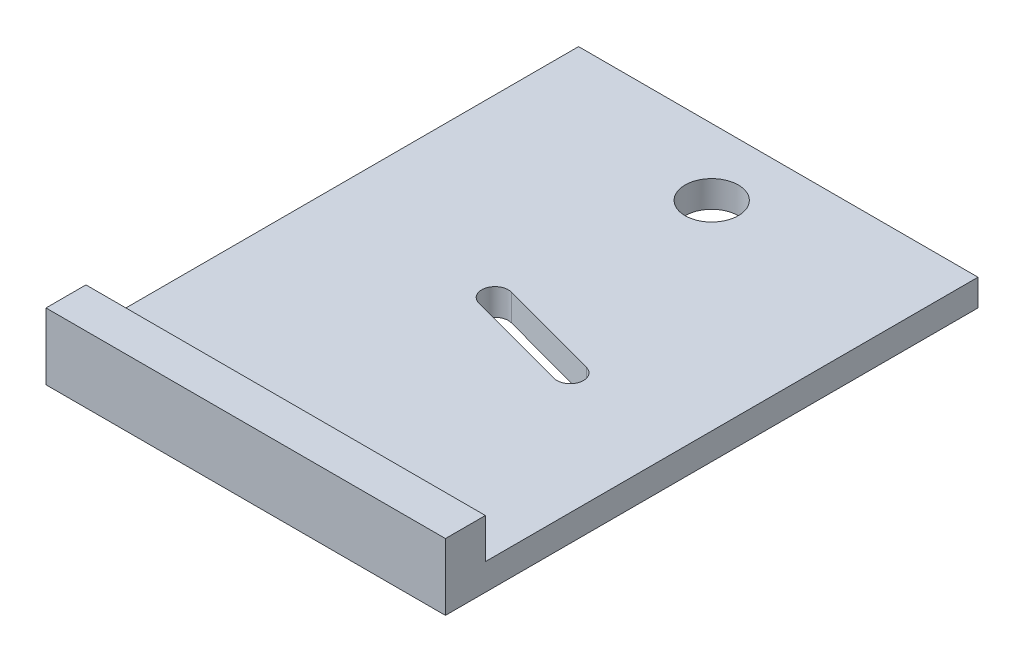
from build123d import *

# Parameters (mm, degrees)
SKETCH1_W                 = 60
SKETCH1_H                 = 80
BOSS_EXTRUDE1_DEPTH       = 4
SKETCH2_W                 = 60
SKETCH2_H                 = 10
BOSS_EXTRUDE2_DEPTH       = 6
F_8_0MM_DOWEL_HOLE1_D     = 8
F_8_0MM_DOWEL_HOLE1_DEPTH = 6
CUT_EXTRUDE1_DEPTH        = 101.498756211


with BuildPart() as part:
    # Sketch1 → Boss-Extrude1 (new body)
    with BuildSketch(Plane(origin=(0, 0, 0), x_dir=(1, 0, 0), z_dir=(0, 1, 0))):
        with Locations((30, 40)):
            Rectangle(SKETCH1_W, SKETCH1_H)
    extrude(amount=BOSS_EXTRUDE1_DEPTH)

    # Sketch2 → Boss-Extrude2 (add)
    with BuildSketch(Plane.XY):
        with Locations((30, 5)):
            Rectangle(SKETCH2_W, SKETCH2_H)
    extrude(amount=-BOSS_EXTRUDE2_DEPTH)

    # Ø8.0mm Dowel Hole1
    with Locations(Plane(origin=(0, 4, 0), x_dir=(1, 0, 0), z_dir=(0, 1, 0))):
        with Locations((30, 70)):
            Hole(F_8_0MM_DOWEL_HOLE1_D / 2, depth=F_8_0MM_DOWEL_HOLE1_DEPTH)

    # Sketch6 → Cut-Extrude1 (cut, through all)
    with BuildSketch(Plane.XZ):
        with BuildLine():
            Line((25.84299387, -39.154412182), (41.293514764, -34.997321359))
            ThreePointArc((41.293514764, -34.997321359), (43.744466229, -36.409000118), (42.33278747, -38.859951582))
            Line((42.33278747, -38.859951582), (26.882266576, -43.017042406))
            ThreePointArc((26.882266576, -43.017042406), (24.431315112, -41.605363647), (25.84299387, -39.154412182))
        make_face()
    extrude(amount=-CUT_EXTRUDE1_DEPTH, mode=Mode.SUBTRACT)


solid = part.part
